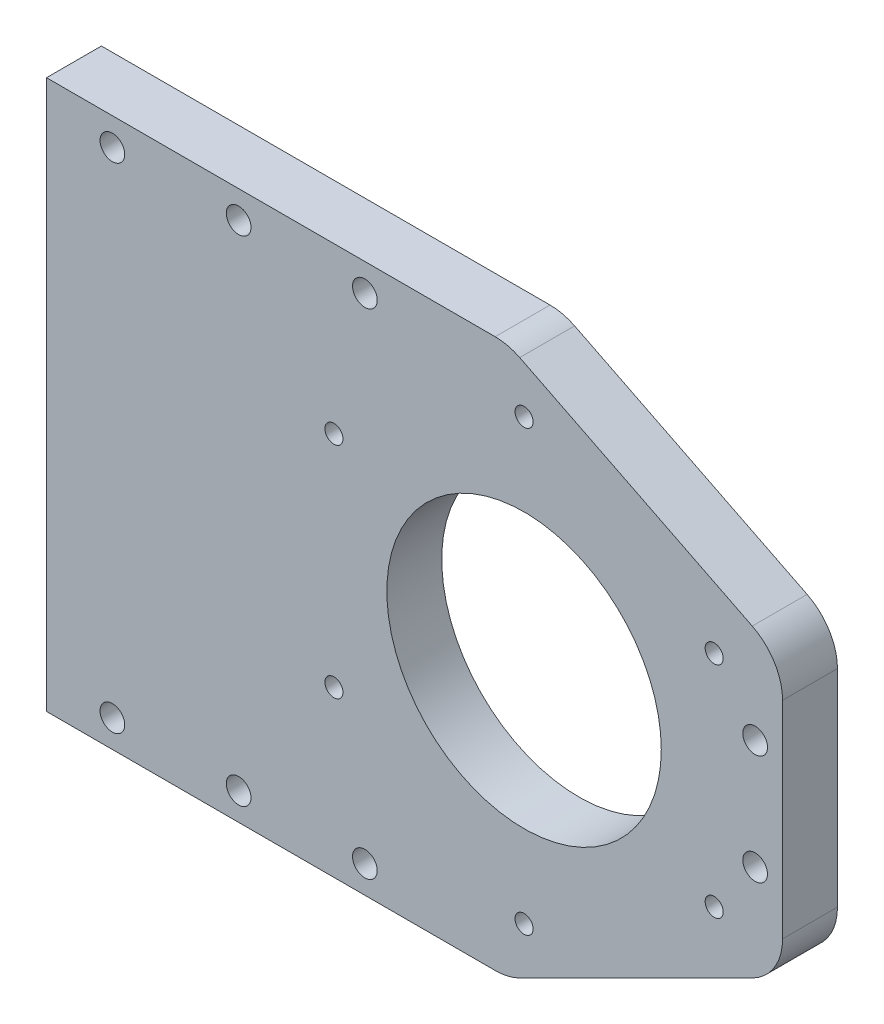
from build123d import *

# Parameters (mm, degrees)
EXTRUDE1_DEPTH                                  = 10
SKETCH5_R                                       = 25
CUT_EXTRUDE1_DEPTH                              = 20
SKETCH6_R                                       = 1.65
CUT_EXTRUDE2_DEPTH                              = 15
CUT_EXTRUDE3_REACH                              = 145.467
SKETCH7_R                                       = 1.5
CSK_FOR_M4_FLAT_HEAD_MACHINE_SCREW1_D           = 4.5
CSK_FOR_M4_FLAT_HEAD_MACHINE_SCREW1_CSINK_D     = 9.4
CSK_FOR_M4_FLAT_HEAD_MACHINE_SCREW1_CSINK_ANGLE = 90
SKETCH10_R                                      = 1.65
CUT_EXTRUDE4_DEPTH                              = 10
FILLET1_R                                       = 10
SKETCH13_R                                      = 2.25
CUT_EXTRUDE5_DEPTH                              = 10
CSK_FOR_M4_FLAT_HEAD_MACHINE_SCREW3_D           = 4.5
CSK_FOR_M4_FLAT_HEAD_MACHINE_SCREW3_CSINK_D     = 9.4
CSK_FOR_M4_FLAT_HEAD_MACHINE_SCREW3_CSINK_ANGLE = 90


with BuildPart() as part:
    # Sketch1 → Extrude1 (new body)
    with BuildSketch(Plane.XY):
        Polygon((0, -50), (84.1, -50), (134.1, -25), (134.1, 25), (84.1, 50), (0, 50), align=None)
    extrude(amount=EXTRUDE1_DEPTH)

    # Sketch5 → Cut-Extrude1 (cut)
    with BuildSketch(Plane.XY.offset(10)):
        with Locations((87, 0)):
            Circle(SKETCH5_R)
    extrude(amount=-CUT_EXTRUDE1_DEPTH, mode=Mode.SUBTRACT)

    # Sketch6 → Cut-Extrude2 (cut)
    with BuildSketch(Plane.ZY):
        with Locations((5, 37.5)):
            Circle(SKETCH6_R)
        with Locations((5, 12.5)):
            Circle(SKETCH6_R)
        with Locations(Location((5, -37.5, 0), (0, 0, 180))):
            Circle(SKETCH6_R)
        with Locations(Location((5, -12.5, 0), (0, 0, 180))):
            Circle(SKETCH6_R)
    extrude(amount=-CUT_EXTRUDE2_DEPTH, mode=Mode.SUBTRACT)

    # Sketch7 → Cut-Extrude3 (cut, up to next)
    with BuildSketch(Plane(origin=(0, 0, 0), x_dir=(-1, 0, 0), z_dir=(0, 0, -1)), mode=Mode.PRIVATE) as cut_extrude3_sk1:
        with Locations((-12, 45)):
            Circle(SKETCH7_R)
    cut_extrude3_tool1 = extrude(cut_extrude3_sk1.sketch, amount=-CUT_EXTRUDE3_REACH, mode=Mode.PRIVATE) & part.part
    # Sketch7 → Cut-Extrude3 (cut, up to next)
    with BuildSketch(Plane(origin=(0, 0, 0), x_dir=(-1, 0, 0), z_dir=(0, 0, -1)), mode=Mode.PRIVATE) as cut_extrude3_sk2:
        with Locations(Location((-35, 45, 0), (0, 0, 180))):
            Circle(SKETCH7_R)
    cut_extrude3_tool2 = extrude(cut_extrude3_sk2.sketch, amount=-CUT_EXTRUDE3_REACH, mode=Mode.PRIVATE) & part.part
    # Sketch7 → Cut-Extrude3 (cut, up to next)
    with BuildSketch(Plane(origin=(0, 0, 0), x_dir=(-1, 0, 0), z_dir=(0, 0, -1)), mode=Mode.PRIVATE) as cut_extrude3_sk3:
        with Locations(Location((-58, 45, 0), (0, 0, 180))):
            Circle(SKETCH7_R)
    cut_extrude3_tool3 = extrude(cut_extrude3_sk3.sketch, amount=-CUT_EXTRUDE3_REACH, mode=Mode.PRIVATE) & part.part
    # Sketch7 → Cut-Extrude3 (cut, up to next)
    with BuildSketch(Plane(origin=(0, 0, 0), x_dir=(-1, 0, 0), z_dir=(0, 0, -1)), mode=Mode.PRIVATE) as cut_extrude3_sk4:
        with Locations((-58, -45)):
            Circle(SKETCH7_R)
    cut_extrude3_tool4 = extrude(cut_extrude3_sk4.sketch, amount=-CUT_EXTRUDE3_REACH, mode=Mode.PRIVATE) & part.part
    # Sketch7 → Cut-Extrude3 (cut, up to next)
    with BuildSketch(Plane(origin=(0, 0, 0), x_dir=(-1, 0, 0), z_dir=(0, 0, -1)), mode=Mode.PRIVATE) as cut_extrude3_sk5:
        with Locations((-35, -45)):
            Circle(SKETCH7_R)
    cut_extrude3_tool5 = extrude(cut_extrude3_sk5.sketch, amount=-CUT_EXTRUDE3_REACH, mode=Mode.PRIVATE) & part.part
    # Sketch7 → Cut-Extrude3 (cut, up to next)
    with BuildSketch(Plane(origin=(0, 0, 0), x_dir=(-1, 0, 0), z_dir=(0, 0, -1)), mode=Mode.PRIVATE) as cut_extrude3_sk6:
        with Locations(Location((-12, -45, 0), (0, 0, 180))):
            Circle(SKETCH7_R)
    cut_extrude3_tool6 = extrude(cut_extrude3_sk6.sketch, amount=-CUT_EXTRUDE3_REACH, mode=Mode.PRIVATE) & part.part
    add(cut_extrude3_tool1.solids().sort_by_distance((12, 45, 0))[0], mode=Mode.SUBTRACT)
    add(cut_extrude3_tool2.solids().sort_by_distance((35, 45, 0))[0], mode=Mode.SUBTRACT)
    add(cut_extrude3_tool3.solids().sort_by_distance((58, 45, 0))[0], mode=Mode.SUBTRACT)
    add(cut_extrude3_tool4.solids().sort_by_distance((58, -45, 0))[0], mode=Mode.SUBTRACT)
    add(cut_extrude3_tool5.solids().sort_by_distance((35, -45, 0))[0], mode=Mode.SUBTRACT)
    add(cut_extrude3_tool6.solids().sort_by_distance((12, -45, 0))[0], mode=Mode.SUBTRACT)

    # CSK for M4 Flat Head Machine Screw1 (through all)
    with Locations(Plane(origin=(0, 0, 0), x_dir=(-1, 0, 0), z_dir=(0, 0, -1))):
        with Locations((-12, 45), (-35, 45), (-58, 45), (-12, -45), (-35, -45), (-58, -45)):
            CounterSinkHole(CSK_FOR_M4_FLAT_HEAD_MACHINE_SCREW1_D / 2, CSK_FOR_M4_FLAT_HEAD_MACHINE_SCREW1_CSINK_D / 2, counter_sink_angle=CSK_FOR_M4_FLAT_HEAD_MACHINE_SCREW1_CSINK_ANGLE)

    # Sketch10 → Cut-Extrude4 (cut)
    with BuildSketch(Plane(origin=(0, 0, 0), x_dir=(-1, 0, 0), z_dir=(0, 0, -1))):
        with Locations((-87, 40)):
            Circle(SKETCH10_R)
        with Locations((-52.358983849, 20)):
            Circle(SKETCH10_R)
        with Locations((-52.358983849, -20)):
            Circle(SKETCH10_R)
        with Locations((-87, -40)):
            Circle(SKETCH10_R)
        with Locations((-121.641016151, -20)):
            Circle(SKETCH10_R)
        with Locations((-121.641016151, 20)):
            Circle(SKETCH10_R)
    extrude(amount=-CUT_EXTRUDE4_DEPTH, mode=Mode.SUBTRACT)

    # Fillet1
    fillet1_edges = [part.edges().sort_by_distance(p)[0] for p in [
        (84.1, 50, 5),
        (134.1, 25, 5),
        (134.1, -25, 5),
        (84.1, -50, 5),
    ]]
    fillet(fillet1_edges, radius=FILLET1_R)

    # Sketch13 → Cut-Extrude5 (cut)
    with BuildSketch(Plane(origin=(0, 0, 0), x_dir=(-1, 0, 0), z_dir=(0, 0, -1))):
        with Locations((-129.1, 10)):
            Circle(SKETCH13_R)
        with Locations(Location((-129.1, -10, 0), (0, 0, 180))):
            Circle(SKETCH13_R)
    extrude(amount=-CUT_EXTRUDE5_DEPTH, mode=Mode.SUBTRACT)

    # CSK for M4 Flat Head Machine Screw3 (through all)
    with Locations(Plane(origin=(0, 0, 0), x_dir=(-1, 0, 0), z_dir=(0, 0, -1))):
        with Locations((-129.1, 10), (-129.1, -10)):
            CounterSinkHole(CSK_FOR_M4_FLAT_HEAD_MACHINE_SCREW3_D / 2, CSK_FOR_M4_FLAT_HEAD_MACHINE_SCREW3_CSINK_D / 2, counter_sink_angle=CSK_FOR_M4_FLAT_HEAD_MACHINE_SCREW3_CSINK_ANGLE)


solid = part.part
